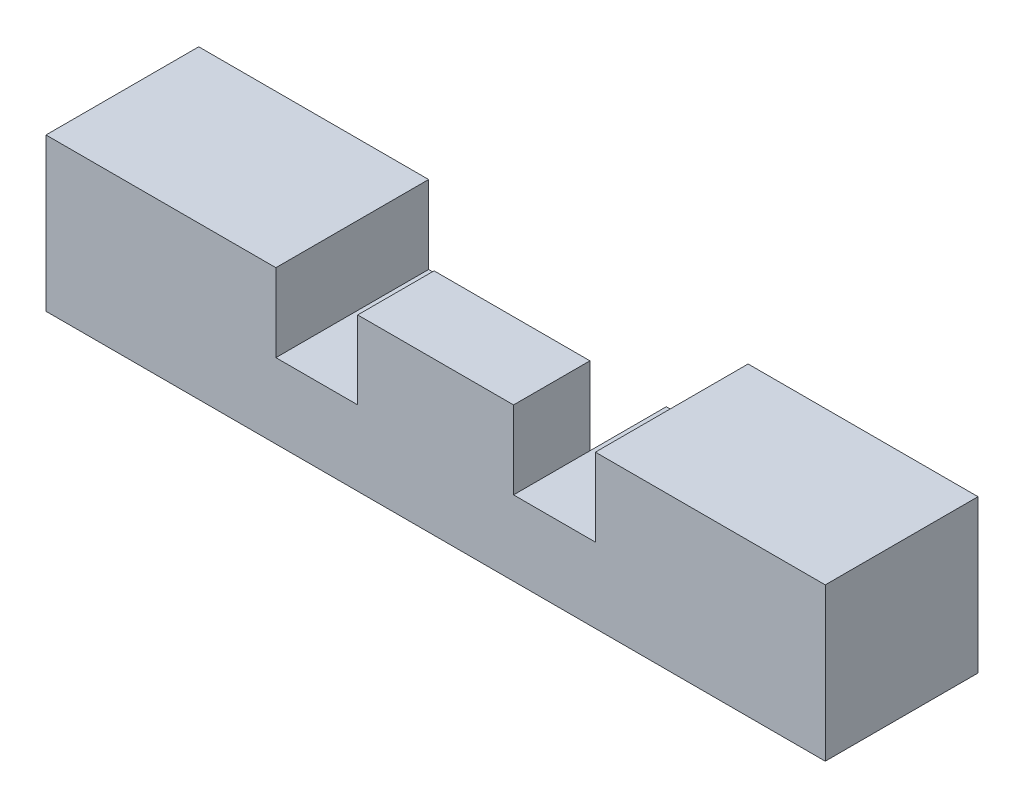
from build123d import *

# Parameters (mm, degrees)
SKETCH_1_W          = 100
SKETCH_1_H          = 19.6
EXTRUDE_1_DEPTH     = 19.6
SKETCH_3_W          = 41
SKETCH_3_H          = 19.6
CUT_EXTRUDE_1_DEPTH = 10
SKETCH_6_W          = 20
SKETCH_6_H          = 19.6
CUT_EXTRUDE_2_DEPTH = 15.5
SKETCH_22_W         = 20
SKETCH_22_H         = 9.8
EXTRUDE_4_DEPTH     = 10
SHELL_3_T           = -2
SKETCH_23_W         = 15.6
SKETCH_23_H         = 15.6
EXTRUDE_5_DEPTH     = 0.5


with BuildPart() as part:
    # 草圖1 → 填料-伸長1 (new body)
    with BuildSketch(Plane.XY):
        Rectangle(SKETCH_1_W, SKETCH_1_H)
    extrude(amount=EXTRUDE_1_DEPTH)

    # 草圖3 → 除料-伸長1 (cut)
    with BuildSketch(Plane(origin=(0, 9.8, 0), x_dir=(1, 0, 0), z_dir=(0, 1, 0))):
        with Locations((0, -9.8)):
            Rectangle(SKETCH_3_W, SKETCH_3_H)
    extrude(amount=-CUT_EXTRUDE_1_DEPTH, mode=Mode.SUBTRACT)

    # 草圖6 → 除料-伸長2 (cut)
    with BuildSketch(Plane(origin=(0, -0.2, 0), x_dir=(1, 0, 0), z_dir=(0, 1, 0))):
        Rectangle(SKETCH_6_W, SKETCH_6_H)
    extrude(amount=-CUT_EXTRUDE_2_DEPTH, mode=Mode.SUBTRACT)

    # 草圖22 → 填料-伸長4 (add)
    with BuildSketch(Plane(origin=(0, -0.2, 0), x_dir=(1, 0, 0), z_dir=(0, 1, 0))):
        with Locations((0, -14.7)):
            Rectangle(SKETCH_22_W, SKETCH_22_H)
    extrude(amount=EXTRUDE_4_DEPTH)

    # 薄殼3
    shell_3_openings = [part.faces().sort_by_distance(p)[0] for p in [
        (-50, 0, 9.8),
    ]]
    offset(amount=SHELL_3_T, openings=shell_3_openings, kind=Kind.INTERSECTION)

    # 草圖23 → 填料-伸長5 (add)
    with BuildSketch(Plane.ZY.offset(50)):
        with Locations((9.8, 0)):
            Rectangle(SKETCH_23_W, SKETCH_23_H)
    extrude(amount=-EXTRUDE_5_DEPTH)


solid = part.part
